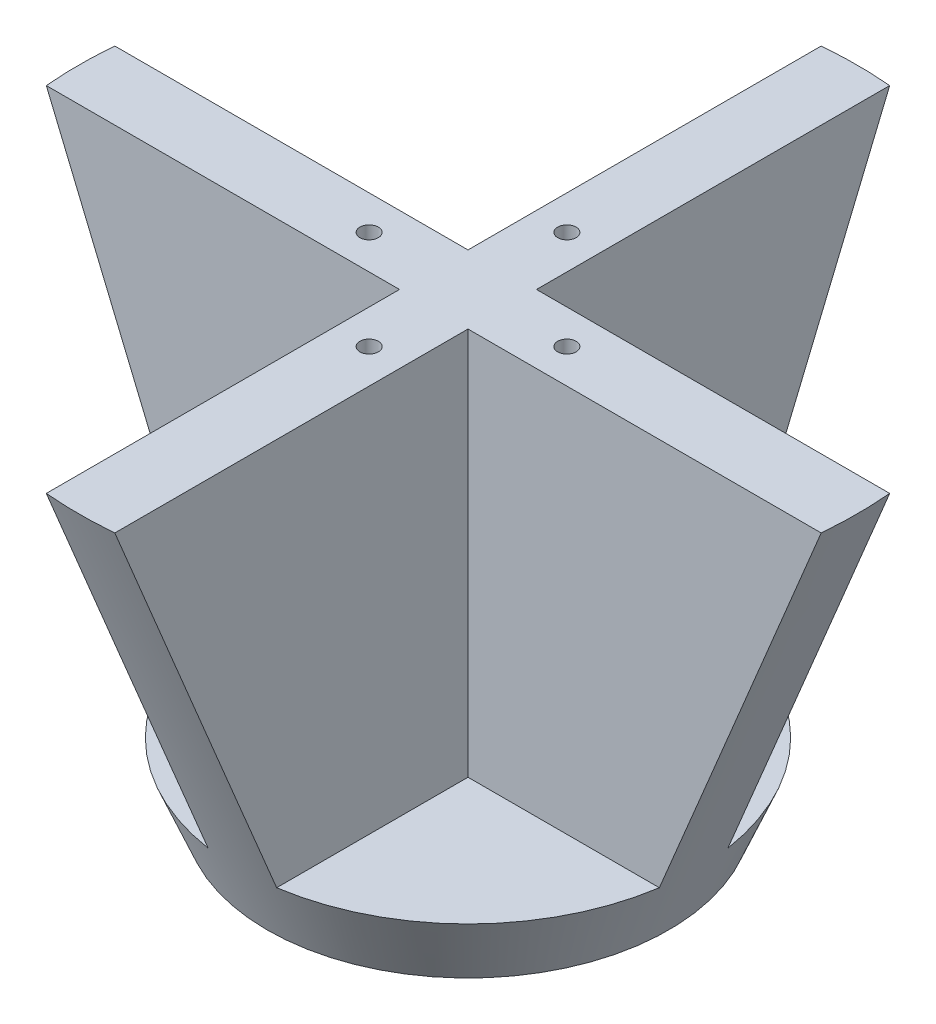
from build123d import *

# Parameters (mm, degrees)
M2_5X0_45_TAPPED_HOLE1_D     = 2.05
M2_5X0_45_TAPPED_HOLE1_DEPTH = 12.7
M2_5X0_45_TAPPED_HOLE1_TIP   = 0.615882135
CROSS_WEIGHT_REDUCTION_DEPTH = 43.18
SKETCH5_R                    = 33.817028943
CUT_EXTRUDE1_DEPTH           = 0.254


with BuildPart() as part:
    # Sketch1 → Revolve1 (revolve)
    with BuildSketch(Plane(origin=(0, 0, 0), x_dir=(0, 0, -1), z_dir=(1, 0, 0))):
        Polygon((0, 0), (-19.05, 0), (-19.05, -5.08), (-22.225, -5.08), (-43.267048969, 45.72), (0, 45.72), align=None)
    revolve(axis=Axis((0, 0, 0), (0, -1, 0)))

    # M2.5x0.45 Tapped Hole1
    with Locations(Plane(origin=(0, 45.72, 0), x_dir=(1, 0, 0), z_dir=(0, 1, 0))):
        with Locations((0, 11), (11, 0), (0, -11), (-11, 0)):
            Hole(M2_5X0_45_TAPPED_HOLE1_D / 2, depth=M2_5X0_45_TAPPED_HOLE1_DEPTH)
            with Locations((0, 0, -(M2_5X0_45_TAPPED_HOLE1_DEPTH + M2_5X0_45_TAPPED_HOLE1_TIP / 2))):  # 118° drill point
                Cone(0, M2_5X0_45_TAPPED_HOLE1_D / 2, M2_5X0_45_TAPPED_HOLE1_TIP, mode=Mode.SUBTRACT)

    # Sketch2 → cross_weight_reduction (cut)
    with BuildSketch(Plane(origin=(0, 45.72, 0), x_dir=(1, 0, 0), z_dir=(0, 1, 0))):
        with BuildLine():
            Line((-3.81, -3.81), (-3.81, -43.098972452))
            ThreePointArc((-3.81, -43.098972452), (-30.594423728, -30.594423728), (-43.098972452, -3.81))
            Line((-43.098972452, -3.81), (-3.81, -3.81))
        make_face()
        with BuildLine():
            Line((-3.81, 43.098972452), (-3.81, 3.81))
            Line((-3.81, 3.81), (-43.098972452, 3.81))
            ThreePointArc((-43.098972452, 3.81), (-30.594423728, 30.594423728), (-3.81, 43.098972452))
        make_face()
        with BuildLine():
            Line((3.81, -43.098972452), (3.81, -3.81))
            Line((3.81, -3.81), (43.098972452, -3.81))
            ThreePointArc((43.098972452, -3.81), (30.594423728, -30.594423728), (3.81, -43.098972452))
        make_face()
        with BuildLine():
            Line((3.81, 3.81), (43.098972452, 3.81))
            ThreePointArc((43.098972452, 3.81), (30.594423728, 30.594423728), (3.81, 43.098972452))
            Line((3.81, 43.098972452), (3.81, 3.81))
        make_face()
    extrude(amount=-CROSS_WEIGHT_REDUCTION_DEPTH, mode=Mode.SUBTRACT)

    # Sketch5 → Cut-Extrude1 (cut)
    with BuildSketch(Plane.XZ.offset(5.08)):
        Circle(SKETCH5_R)
    extrude(amount=-CUT_EXTRUDE1_DEPTH, mode=Mode.SUBTRACT)


solid = part.part
